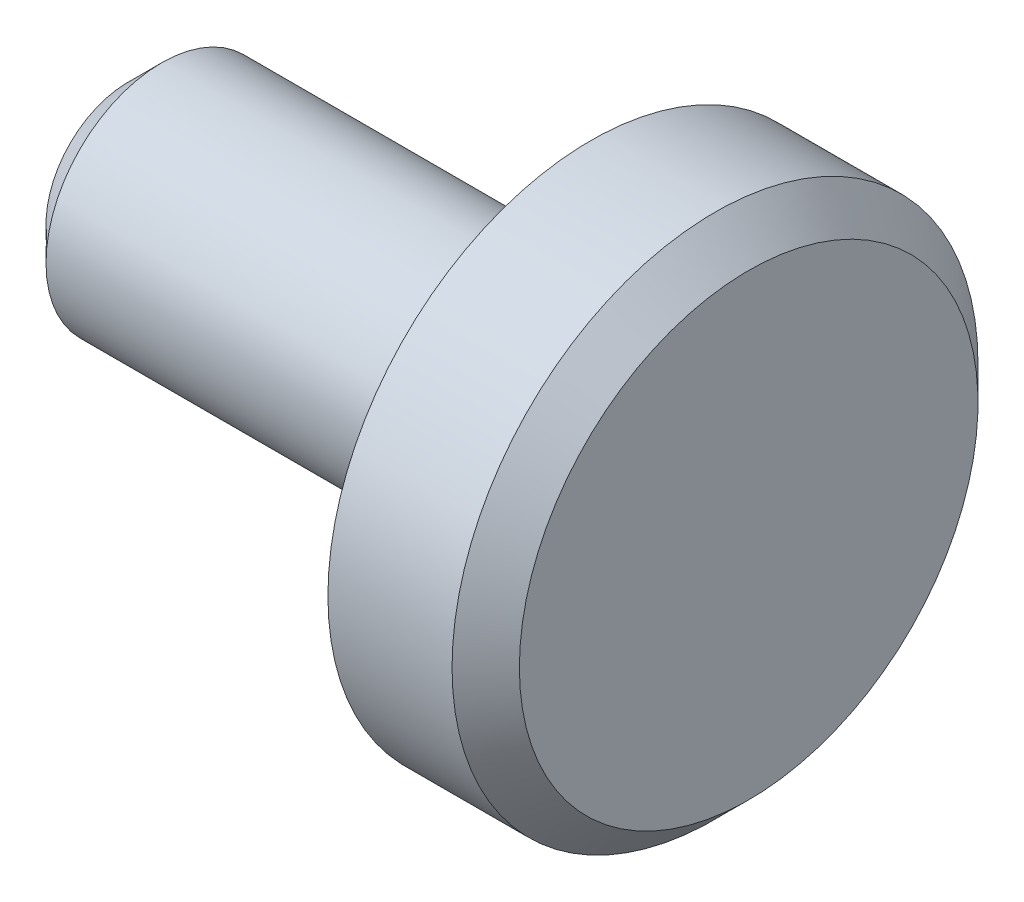
from build123d import *

# Parameters (mm, degrees)
CHAMFER1_SIZE = 0.8128


with BuildPart() as part:
    # Sketch1 → Revolve1 (revolve)
    with BuildSketch(Plane.XY, mode=Mode.PRIVATE) as revolve1_sk:
        Polygon((0, 0), (0, 6.35), (-3.81, 6.35), (-3.81, 2.794), (-14.986, 2.794), (-14.986, 0), align=None)
    revolve(revolve1_sk.sketch.rotate(Axis((-14.986, 0, 0), (1, 0, 0)), 90), axis=Axis((-14.986, 0, 0), (1, 0, 0)))

    # Chamfer1
    chamfer1_edges = [part.edges().sort_by_distance(p)[0] for p in [
        (-14.986, 0, -2.794),
        (0, 0, -6.35),
    ]]
    chamfer(chamfer1_edges, length=CHAMFER1_SIZE)


solid = part.part
